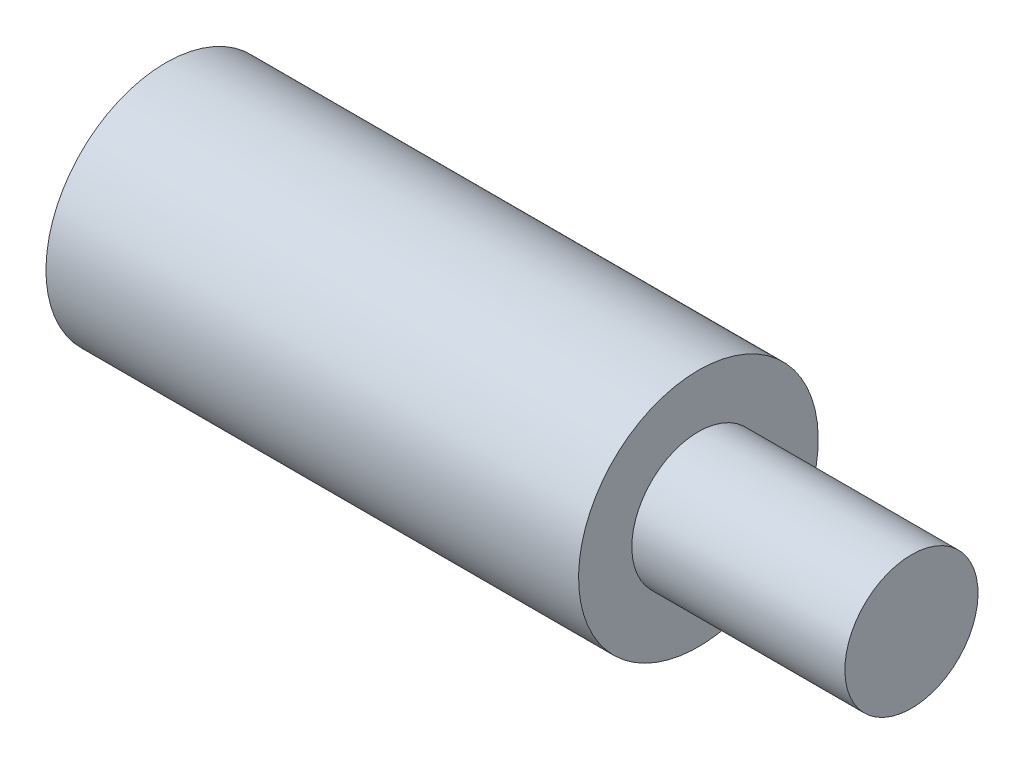
from build123d import *

# Parameters (mm, degrees)
HOLE_WIZARD_M3_1_D     = 2.5
HOLE_WIZARD_M3_1_DEPTH = 5
HOLE_WIZARD_M3_1_TIP   = 0.751075774


with BuildPart() as part:
    # 草图2 → 旋转1 (revolve)
    with BuildSketch(Plane.XY):
        Polygon((0, 0), (0, 9), (40, 9), (40, 5), (56, 5), (56, 0), align=None)
    revolve(axis=Axis((56, 0, 0), (-1, 0, 0)))

    # M3 螺纹孔1
    with Locations(Plane.ZY):
        with Locations((-5, 5), (5, 5), (5, -5), (-5, -5)):
            Hole(HOLE_WIZARD_M3_1_D / 2, depth=HOLE_WIZARD_M3_1_DEPTH)
            with Locations((0, 0, -(HOLE_WIZARD_M3_1_DEPTH + HOLE_WIZARD_M3_1_TIP / 2))):  # 118° drill point
                Cone(0, HOLE_WIZARD_M3_1_D / 2, HOLE_WIZARD_M3_1_TIP, mode=Mode.SUBTRACT)


solid = part.part
